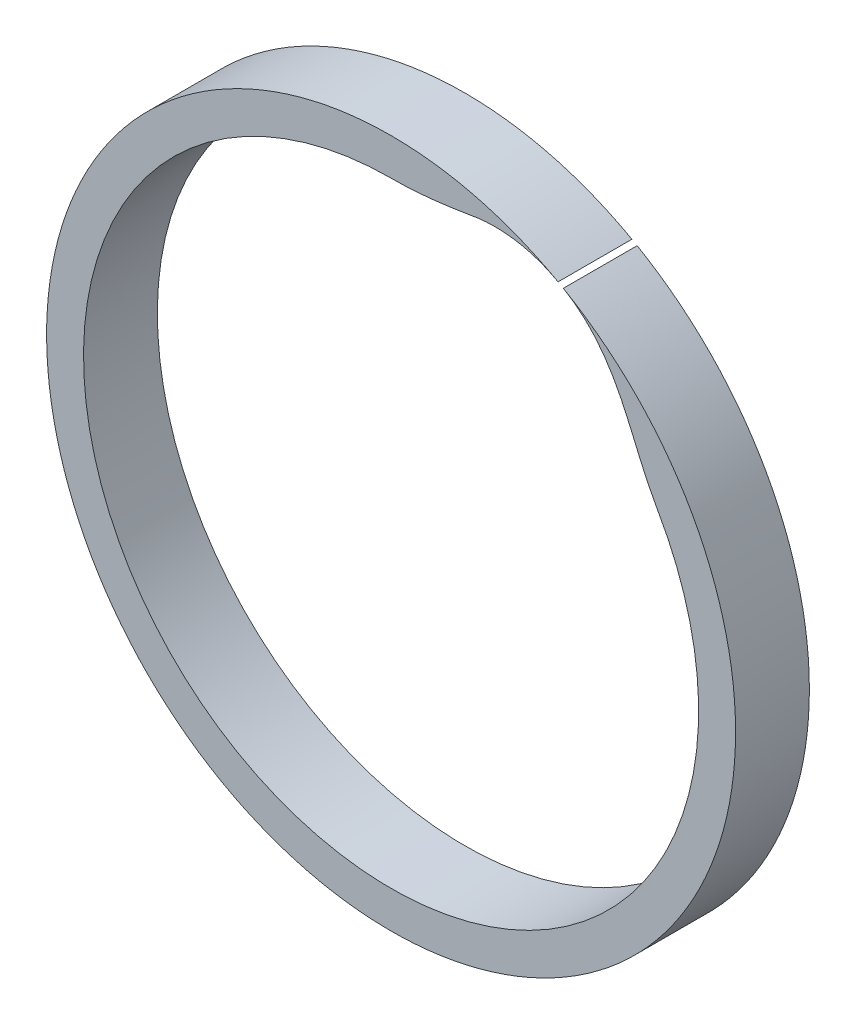
from build123d import *

# Parameters (mm, degrees)
EXTRUDE_1_DEPTH = 12


with BuildPart() as part:
    # 草图1 → 凸台-拉伸1 (new body)
    with BuildSketch(Plane.XY):
        with BuildLine():
            ThreePointArc((27.149338734, 48.9787036), (-27.575719366, -48.739918973), (28, 48.497422612))
            add(Edge.make_bspline(
                [(28, 48.497422612), (28.564535987, 48.171560035), (29.386465895, 47.638946939), (30.425231829, 46.84841548), (31.175411799, 46.216604933), (31.895504924, 45.548314243), (32.58496303, 44.845995921), (33.243553789, 44.11232907), (33.871369445, 43.350183341), (34.468827797, 42.562577681), (35.036669109, 41.752638795), (35.575948058, 40.923558717), (36.088021127, 40.078552353), (36.574529557, 39.220815456), (37.037378064, 38.353483584), (37.478709584, 37.479592595), (37.90087635, 36.602041187), (38.306407644, 35.723556025), (38.697974626, 34.846659935), (39.078352671, 33.97364363), (39.450381689, 33.106541359), (39.816924915, 32.247110829), (40.180826675, 31.396817644), (40.544869672, 30.556824428), (40.911732242, 29.727984618), (41.283946525, 28.910841049), (41.663856748, 28.105628436), (42.053583673, 27.312282062), (42.587882239, 26.271566137), (43.009922407, 25.504498115), (43.301270189, 25)],
                knots=[0, 0, 0, 0, 0.06852399, 0.102830464, 0.137186328, 0.171601635, 0.206081397, 0.240624839, 0.275224955, 0.309868372, 0.34453551, 0.379201042, 0.413834616, 0.448401815, 0.482865314, 0.517186208, 0.551325448, 0.585245367, 0.618911236, 0.652292805, 0.685365785, 0.718113204, 0.750526587, 0.782606885, 0.814365099, 0.845822519, 0.87701054, 0.907970001, 0.938750046, 1, 1, 1, 1], degree=3))
            ThreePointArc((43.301270189, 25), (-25, -43.301270189), (0, 50))
            add(Edge.make_bspline(
                [(0, 50), (0.582412989, 49.999984085), (1.457217, 50.013408169), (2.625036634, 50.057630973), (3.505757926, 50.103957683), (4.391364675, 50.163233247), (5.283068256, 50.235241673), (6.18207324, 50.319720515), (7.089576152, 50.41635949), (8.006763651, 50.524804063), (8.934812603, 50.644644338), (9.87488298, 50.775458938), (10.828138017, 50.916649647), (11.795660319, 51.068075038), (12.777795571, 51.227471801), (13.768067559, 51.3988271), (14.768807795, 51.520008157), (15.770286867, 51.595850519), (16.770127762, 51.624835615), (17.766443396, 51.607638647), (18.757480091, 51.544452671), (19.74146457, 51.43567035), (20.716646687, 51.28170181), (21.681290005, 51.083022628), (22.633676226, 50.840160365), (23.572106021, 50.553697669), (24.494900403, 50.22427006), (25.701892755, 49.728809229), (26.5793214, 49.294685742), (27.149338734, 48.9787036)],
                knots=[0, 0, 0, 0, 0.063088983, 0.094762328, 0.126589681, 0.158621369, 0.19090688, 0.223494699, 0.25643215, 0.289765272, 0.323538716, 0.357795666, 0.392577785, 0.427925179, 0.463876389, 0.50036191, 0.536773825, 0.573023128, 0.609123022, 0.64508655, 0.680926607, 0.716655949, 0.752287205, 0.787832892, 0.823305426, 0.858717135, 0.894080272, 0.929407034, 1, 1, 1, 1], degree=3))
        make_face()
    extrude(amount=EXTRUDE_1_DEPTH)


solid = part.part
